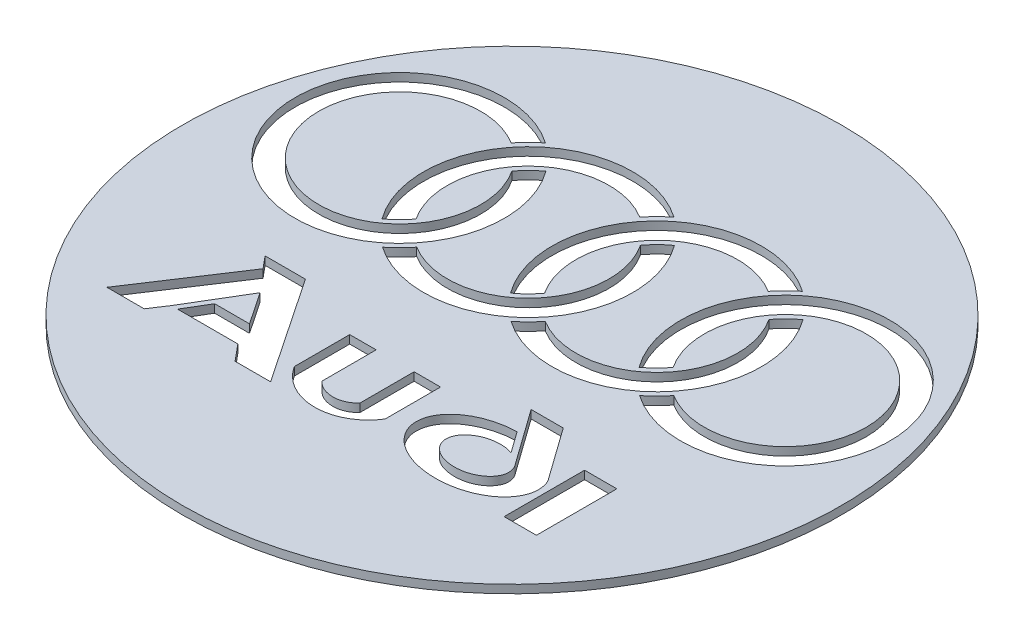
from build123d import *

# Parameters (mm, degrees)
SKETCH1_R           = 127
BOSS_EXTRUDE1_DEPTH = 3.175
SKETCH2_W           = 12.438745875
SKETCH2_H           = 31.000011437
CUT_EXTRUDE1_DEPTH  = 3.175


with BuildPart() as part:
    # Sketch1 → Boss-Extrude1 (new body)
    with BuildSketch(Plane(origin=(0, 0, 0), x_dir=(1, 0, 0), z_dir=(0, 1, 0))):
        with Locations(Location((0, 0, 0), (0, 0, 270))):
            Circle(SKETCH1_R)
    extrude(amount=BOSS_EXTRUDE1_DEPTH)

    # Sketch2 → Cut-Extrude1 (cut)
    with BuildSketch(Plane(origin=(0, 3.175, 0), x_dir=(1, 0, 0), z_dir=(0, 1, 0))):
        Polygon((-51.846570392, -27.761273072), (-67.392708125, -27.761273072), (-63.49777994, -32.449612553), (-87.392519872, -68.724363756), (-73.025563352, -68.724363756), (-68.858940519, -62.398988085), (-63.49777994, -53.443146367), (-56.052860633, -41.035320282), (-47.711513929, -53.443146367), (-61.129520895, -53.443146367), (-66.490681474, -62.398988085), (-43.246780748, -62.398988085), (-37.991853267, -68.724363756), (-24.308519881, -68.724363756), align=None)
        with BuildLine():
            Line((47.513174781, -27.761273072), (35.129585086, -27.761273072))
            Line((35.129585086, -27.761273072), (50.616895331, -49.460734396))
            add(Edge.make_bspline(
                [(45.679130911, -46.040196269), (31.550212316, -41.255173944), (28.733398827, -52.539450499), (25.916585337, -63.823727055), (41.797676766, -61.589469293), (57.678768195, -59.355211531), (50.616895331, -49.460734396)],
                knots=[1.020082476, 1.020082476, 1.020082476, 2.907145281, 2.907145281, 4.794208086, 4.794208086, 6.681270891, 6.681270891, 6.681270891], degree=2, weights=[1, 0.586932541, 1, 0.586932541, 1, 0.586932541, 1]))
            Line((45.679130911, -46.040196269), (39.850903677, -37.874195236))
            add(Edge.make_bspline(
                [(39.850903677, -37.874195236), (-30.231497677, -39.73502536), (26.658902193, -66.440769536), (83.549302064, -93.146513713), (62.228166445, -48.37862931)],
                knots=[1.563851242, 1.563851242, 1.563851242, 4.067513609, 4.067513609, 6.571175976, 6.571175976, 6.571175976], degree=2, weights=[1, 0.31358407, 1, 0.31358407, 1]))
            Line((62.228166445, -48.37862931), (47.513174781, -27.761273072))
        make_face()
        with BuildLine():
            Line((-14.629199742, -37.724352319), (-24.813373872, -37.724352319))
            Line((-24.813373872, -37.724352319), (-24.813373872, -59.074478125))
            ThreePointArc((-24.813373872, -59.074478125), (-7.314599871, -68.724363756), (10.184174129, -59.074478125))
            Line((10.184174129, -59.074478125), (10.184174129, -37.724352319))
            Line((10.184174129, -37.724352319), (0, -37.724352319))
            Line((0, -37.724352319), (0, -58.665309043))
            ThreePointArc((0, -58.665309043), (-7.314599871, -61.774148851), (-14.629199742, -58.665309043))
            Line((-14.629199742, -58.665309043), (-14.629199742, -37.724352319))
        make_face()
        with Locations((71.910421643, -53.224358038)):
            Rectangle(SKETCH2_W, SKETCH2_H)
        with BuildLine():
            ThreePointArc((-57.663269864, 57.359209553), (-54.545921341, 60.836930705), (-51.064741507, 63.950416403))
            ThreePointArc((-51.064741507, 63.950416403), (-102.357132874, 2.042968688), (-41.531381183, 54.613582399))
            ThreePointArc((-41.531381183, 54.613582399), (-45.091015331, 51.621496868), (-48.12990954, 48.101739338))
            ThreePointArc((-48.12990954, 48.101739338), (-95.868420767, 8.4780016), (-57.663269864, 57.359209553))
        make_face()
        with BuildLine():
            ThreePointArc((-50.606514106, 13.62018236), (-46.986171072, 52.596169792), (-8.133269864, 57.359209553))
            ThreePointArc((-8.133269864, 57.359209553), (-5.015921341, 60.836930705), (-1.534741507, 63.950416403))
            ThreePointArc((-1.534741507, 63.950416403), (-31.275194817, 70.642250855), (-57.205042464, 54.613582399))
            ThreePointArc((-57.205042464, 54.613582399), (-64.940122856, 30.860960849), (-57.205042464, 7.108339298))
            ThreePointArc((-57.205042464, 7.108339298), (-53.645408316, 10.100424829), (-50.606514106, 13.62018236))
        make_face()
        with BuildLine():
            ThreePointArc((-1.076514106, 13.62018236), (2.543828928, 52.596169792), (41.396730136, 57.359209553))
            ThreePointArc((41.396730136, 57.359209553), (44.514078659, 60.836930705), (47.995258493, 63.950416403))
            ThreePointArc((47.995258493, 63.950416403), (-3.891203984, 59.084881899), (-7.675042464, 7.108339298))
            ThreePointArc((-7.675042464, 7.108339298), (-4.115408316, 10.100424829), (-1.076514106, 13.62018236))
        make_face()
        with BuildLine():
            ThreePointArc((48.453485894, 13.62018236), (96.19199712, 53.243920097), (57.986846218, 4.362712144))
            ThreePointArc((57.986846218, 4.362712144), (54.869497694, 0.884990992), (51.38831786, -2.228494706))
            ThreePointArc((51.38831786, -2.228494706), (102.680709227, 59.678953009), (41.854957536, 7.108339298))
            ThreePointArc((41.854957536, 7.108339298), (45.414591684, 10.100424829), (48.453485894, 13.62018236))
        make_face()
        with BuildLine():
            ThreePointArc((1.40009046, 48.101739338), (-2.220252575, 9.125751905), (-41.073153782, 4.362712144))
            ThreePointArc((-41.073153782, 4.362712144), (-44.190502306, 0.884990992), (-47.67168214, -2.228494706))
            ThreePointArc((-47.67168214, -2.228494706), (4.214780337, 2.637039798), (7.998618817, 54.613582399))
            ThreePointArc((7.998618817, 54.613582399), (4.438984669, 51.621496868), (1.40009046, 48.101739338))
        make_face()
        with BuildLine():
            ThreePointArc((50.93009046, 48.101739338), (47.309747425, 9.125751905), (8.456846218, 4.362712144))
            ThreePointArc((8.456846218, 4.362712144), (5.339497694, 0.884990992), (1.85831786, -2.228494706))
            ThreePointArc((1.85831786, -2.228494706), (53.744780337, 2.637039798), (57.528618817, 54.613582399))
            ThreePointArc((57.528618817, 54.613582399), (53.968984669, 51.621496868), (50.93009046, 48.101739338))
        make_face()
    extrude(amount=-CUT_EXTRUDE1_DEPTH, mode=Mode.SUBTRACT)


solid = part.part
